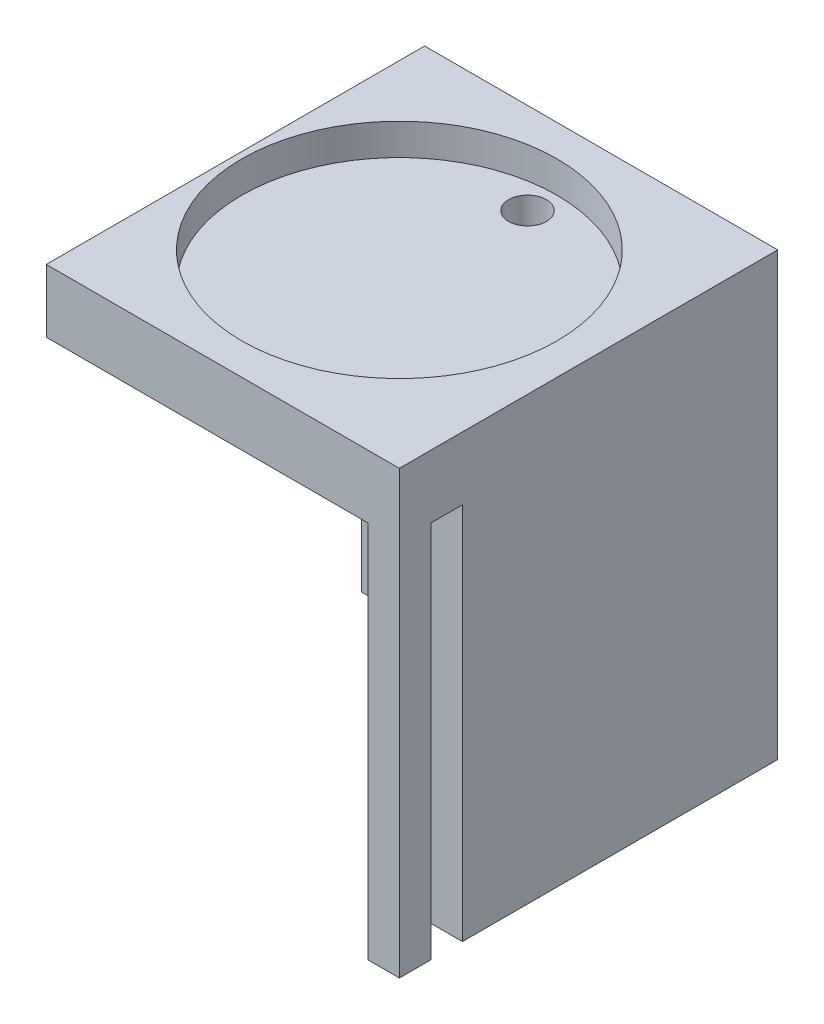
from build123d import *

# Parameters (mm, degrees)
SKETCH1_W                      = 670
SKETCH1_H                      = 120
BOSS_EXTRUDE1_DEPTH            = 530
SKETCH2_W                      = 100
SKETCH2_H                      = 200
SKETCH2_W_2                    = 650
SKETCH2_H_2                    = 250
CUT_EXTRUDE1_DEPTH             = 100
SKETCH3_R                      = 50
CUT_EXTRUDE2_DEPTH             = 260
F_12_0_12_DIAMETER_HOLE2_D     = 12
F_12_0_12_DIAMETER_HOLE2_DEPTH = 30
F_12_0_12_DIAMETER_HOLE2_TIP   = 3.605163714
SKETCH8_W                      = 650
SKETCH8_H                      = 50
BOSS_EXTRUDE2_DEPTH            = 5
SKETCH9_W                      = 10
SKETCH9_H                      = 250
CUT_EXTRUDE3_DEPTH             = 717
CUT_EXTRUDE4_DEPTH             = 5
SKETCH11_W                     = 10
SKETCH11_H                     = 100
BOSS_EXTRUDE3_DEPTH            = 78
BOSS_EXTRUDE3_2_DEPTH          = 78
BOSS_EXTRUDE3_3_DEPTH          = 78
SKETCH12_W                     = 20
SKETCH12_H                     = 30
CUT_EXTRUDE5_DEPTH             = 80
SKETCH15_W                     = 30
SKETCH15_H                     = 23.536156656
SKETCH15_H_2                   = 28.986603691
CUT_EXTRUDE7_DEPTH             = 35
SHELL1_T                       = -3
SKETCH16_W                     = 14
SKETCH16_H                     = 14
CUT_EXTRUDE8_DEPTH             = 35
SKETCH17_W                     = 5.729882812
SKETCH17_H                     = 17.428393554
SKETCH17_W_2                   = 13.369726562
SKETCH17_H_2                   = 3.342431641
BOSS_EXTRUDE4_DEPTH            = 5
CUT_EXTRUDE10_DEPTH            = 863.670273187
CUT_EXTRUDE10_DEPTH_BACK       = 863.670273187
SKETCH18_W                     = 670
SKETCH18_H                     = 250
CUT_EXTRUDE12_DEPTH            = 737.002717386
CUT_EXTRUDE12_DEPTH_BACK       = 737.002717386
SKETCH19_W                     = 558
SKETCH19_H                     = 280
CUT_EXTRUDE13_DEPTH            = 322.253793752
CUT_EXTRUDE13_DEPTH_BACK       = 322.253793752
SKETCH20_W                     = 120
SKETCH20_H                     = 140


with BuildPart() as part:
    # Sketch1 → Boss-Extrude1 (new body)
    with BuildSketch(Plane(origin=(0, 0, 0), x_dir=(1, 0, 0), z_dir=(0, 1, 0))):
        with Locations((335, 60)):
            Rectangle(SKETCH1_W, SKETCH1_H)
    extrude(amount=BOSS_EXTRUDE1_DEPTH)

    # Sketch2 → Cut-Extrude1 (cut)
    with BuildSketch(Plane.XY):
        with Locations((60, 380)):
            Rectangle(SKETCH2_W, SKETCH2_H)
        with Locations((170, 380)):
            Rectangle(SKETCH2_W, SKETCH2_H)
        with Locations((280, 380)):
            Rectangle(SKETCH2_W, SKETCH2_H)
        with Locations((390, 380)):
            Rectangle(SKETCH2_W, SKETCH2_H)
        with Locations((500, 380)):
            Rectangle(SKETCH2_W, SKETCH2_H)
        with Locations((610, 380)):
            Rectangle(SKETCH2_W, SKETCH2_H)
        with Locations((335, 135)):
            Rectangle(SKETCH2_W_2, SKETCH2_H_2)
    extrude(amount=-CUT_EXTRUDE1_DEPTH, mode=Mode.SUBTRACT)

    # Sketch3 → Cut-Extrude2 (cut)
    with BuildSketch(Plane(origin=(0, 530, 0), x_dir=(1, 0, 0), z_dir=(0, 1, 0))):
        with Locations(Location((60, 60, 0), (0, 0, 270))):
            Circle(SKETCH3_R)
        with Locations(Location((170, 60, 0), (0, 0, 270))):
            Circle(SKETCH3_R)
        with Locations(Location((280, 60, 0), (0, 0, 270))):
            Circle(SKETCH3_R)
        with Locations(Location((390, 60, 0), (0, 0, 270))):
            Circle(SKETCH3_R)
        with Locations(Location((500, 60, 0), (0, 0, 270))):
            Circle(SKETCH3_R)
        with Locations(Location((610, 60, 0), (0, 0, 270))):
            Circle(SKETCH3_R)
    extrude(amount=-CUT_EXTRUDE2_DEPTH, mode=Mode.SUBTRACT)

    # Ø12.0 (12) Diameter Hole2
    with Locations(Plane(origin=(59.704642413, 270, -102.411697903), x_dir=(0, 0, 1), z_dir=(0, 1, 0))):
        with Locations((0, 0), (-0.195888006, 111.8520513), (0.014838595, 221.167624818), (-0.341843303, 331.364008353), (0.657723149, 441.008646429), (1.288998006, 549.811854685)):
            Hole(F_12_0_12_DIAMETER_HOLE2_D / 2, depth=F_12_0_12_DIAMETER_HOLE2_DEPTH)
            with Locations((0, 0, -(F_12_0_12_DIAMETER_HOLE2_DEPTH + F_12_0_12_DIAMETER_HOLE2_TIP / 2))):  # 118° drill point
                Cone(0, F_12_0_12_DIAMETER_HOLE2_D / 2, F_12_0_12_DIAMETER_HOLE2_TIP, mode=Mode.SUBTRACT)

    # Sketch8 → Boss-Extrude2 (add)
    with BuildSketch(Plane.XY):
        with Locations((335, 305)):
            Rectangle(SKETCH8_W, SKETCH8_H)
    extrude(amount=-BOSS_EXTRUDE2_DEPTH)

    # Sketch9 → Cut-Extrude3 (cut)
    with BuildSketch(Plane(origin=(670, 0, 0), x_dir=(0, 0, -1), z_dir=(1, 0, 0))):
        with Locations((15, 135)):
            Rectangle(SKETCH9_W, SKETCH9_H)
    extrude(amount=-CUT_EXTRUDE3_DEPTH, mode=Mode.SUBTRACT)

    # Sketch10 → Cut-Extrude4 (cut)
    with BuildSketch(Plane(origin=(0, 10, 0), x_dir=(1, 0, 0), z_dir=(0, 1, 0))):
        Polygon((365, 61.943560596), (350, 87.924322709), (320, 87.924322709), (305, 61.943560596), (320, 35.962798482), (350, 35.962798482), align=None)
    extrude(amount=-CUT_EXTRUDE4_DEPTH, mode=Mode.SUBTRACT)

    # Sketch12 → Cut-Extrude5 (cut)
    with BuildSketch(Plane.XY.offset(-100)):
        with Locations((85.198613037, 245)):
            Rectangle(SKETCH12_W, SKETCH12_H)
        with Locations((195.198613037, 245)):
            Rectangle(SKETCH12_W, SKETCH12_H)
        with Locations((305.198613037, 245)):
            Rectangle(SKETCH12_W, SKETCH12_H)
        with Locations((415.198613037, 245)):
            Rectangle(SKETCH12_W, SKETCH12_H)
        with Locations((525.198613037, 245)):
            Rectangle(SKETCH12_W, SKETCH12_H)
        with Locations((635.198613037, 245)):
            Rectangle(SKETCH12_W, SKETCH12_H)
    extrude(amount=-CUT_EXTRUDE5_DEPTH, mode=Mode.SUBTRACT)

    # Sketch17 → Boss-Extrude4 (add)
    # profile 1 of 9: a face of its own
    with BuildSketch(Plane.XY):
        with BuildLine():
            Line((527.508830928, 289.835452458), (527.508830928, 307.263846012))
            Line((527.508830928, 307.263846012), (534.861434459, 307.263846012))
            add(Edge.make_bspline(
                [(534.861434459, 307.263846012), (535.181337774, 307.258256848), (535.803061116, 307.24739446), (536.703508491, 307.139069344), (537.544992916, 306.975202489), (538.325061607, 306.737496792), (539.040841948, 306.426020155), (539.698044515, 306.051894954), (540.290333057, 305.605079277), (540.822348212, 305.090232636), (541.284521701, 304.502523111), (541.692171296, 303.852565801), (542.030284458, 303.129762281), (542.309377095, 302.341316546), (542.5243908, 301.484161689), (542.679660381, 300.560045938), (542.773357357, 299.567500804), (542.783368073, 298.883107022), (542.788518428, 298.530997273)],
                knots=[0, 0, 0, 0, 1.135059408, 2.20595691, 3.214417064, 4.174978569, 5.094187092, 5.980001006, 6.853065862, 7.720814779, 8.600404634, 9.50058483, 10.438414914, 11.426825708, 12.465239141, 13.571113463, 14.750376389, 16, 16, 16, 16], degree=3))
            add(Edge.make_bspline(
                [(542.788518428, 298.530997273), (542.781740751, 298.180151665), (542.768592871, 297.499553336), (542.676885992, 296.511518461), (542.516733301, 295.591080531), (542.296748778, 294.736450427), (542.003051046, 293.953120444), (541.654236167, 293.233205539), (541.233025793, 292.585291498), (540.753136904, 292.000029304), (540.204772188, 291.484681411), (539.587651059, 291.044279297), (538.910779309, 290.668464036), (538.169670382, 290.361903209), (537.364073889, 290.124869172), (536.495133477, 289.954199984), (535.562644449, 289.853487388), (534.920131033, 289.841584621), (534.58911581, 289.835452458)],
                knots=[0, 0, 0, 0, 1.228418252, 2.382983832, 3.470276728, 4.496757894, 5.468023682, 6.394867725, 7.292157164, 8.167372942, 9.039072913, 9.918728341, 10.815246345, 11.744296628, 12.720973084, 13.750736166, 14.841206188, 16, 16, 16, 16], degree=3))
            Line((534.58911581, 289.835452458), (527.508830928, 289.835452458))
        make_face()
        with BuildLine():
            Line((533.238713741, 291.745413395), (534.048208904, 291.745413395))
            add(Edge.make_bspline(
                [(534.048208904, 291.745413395), (534.172894012, 291.749291978), (534.413033311, 291.756761998), (534.758676231, 291.825976613), (535.075745017, 291.938271137), (535.365749176, 292.094802589), (535.623404602, 292.300450923), (535.848862806, 292.551404902), (536.04776914, 292.844737637), (536.217685755, 293.190205032), (536.364284647, 293.596533622), (536.481764702, 294.076367921), (536.592118304, 294.630928744), (536.673672739, 295.265507643), (536.740044562, 295.978448886), (536.788346679, 296.768428292), (536.812018936, 297.636801208), (536.817188964, 298.241258393), (536.819890499, 298.55711002)],
                knots=[0, 0, 0, 0, 0.728710832, 1.403472396, 2.052289494, 2.690292559, 3.321919393, 3.970736491, 4.656696891, 5.388631723, 6.217040872, 7.17856157, 8.275589967, 9.523440737, 10.918935818, 12.463926104, 14.152268318, 16, 16, 16, 16], degree=3))
            add(Edge.make_bspline(
                [(536.819890499, 298.55711002), (536.8171426, 298.871715251), (536.811863063, 299.476166083), (536.7886758, 300.343334385), (536.739579947, 301.133216935), (536.674703848, 301.843934916), (536.589660404, 302.476324031), (536.488366458, 303.031681737), (536.362441588, 303.507627045), (536.222158727, 303.914921549), (536.050140993, 304.256514038), (535.858357073, 304.554097881), (535.62547107, 304.79746827), (535.36991257, 305.004888479), (535.079348843, 305.160875844), (534.761320266, 305.273944358), (534.414185903, 305.34216807), (534.172870641, 305.349893944), (534.048208904, 305.353885075)],
                knots=[0, 0, 0, 0, 1.842836665, 3.540640921, 5.080358154, 6.47765669, 7.719902824, 8.816971715, 9.781579111, 10.601733135, 11.334613876, 12.017393917, 12.666641099, 13.29908421, 13.937911793, 14.587567384, 15.270347425, 16, 16, 16, 16], degree=3))
            Line((534.048208904, 305.353885075), (533.238713741, 305.353885075))
            Line((533.238713741, 305.353885075), (533.238713741, 291.745413395))
        make_face(mode=Mode.SUBTRACT)
    # profile 2 of 9: a face of its own
    with BuildSketch(Plane.XY):
        with Locations((547.563420772, 298.549649235)):
            Rectangle(SKETCH17_W, SKETCH17_H)
    # profile 3 of 9: a face of its own
    with BuildSketch(Plane.XY):
        Polygon((564.514324092, 307.263846012), (564.514324092, 305.115139958), (558.545696163, 305.115139958), (558.545696163, 299.862747379), (563.559343624, 299.862747379), (563.559343624, 297.714041325), (558.545696163, 297.714041325), (558.545696163, 289.835452458), (552.81581335, 289.835452458), (552.81581335, 307.263846012), align=None)
    # profile 4 of 9: a face of its own
    with BuildSketch(Plane.XY):
        Polygon((577.645305538, 307.263846012), (577.645305538, 305.115139958), (571.676677608, 305.115139958), (571.676677608, 299.862747379), (576.690325069, 299.862747379), (576.690325069, 297.714041325), (571.676677608, 297.714041325), (571.676677608, 289.835452458), (565.946794795, 289.835452458), (565.946794795, 307.263846012), align=None)
    # profile 5 of 9: a face of its own
    with BuildSketch(Plane.XY):
        with Locations((584.330168819, 287.448001286)):
            Rectangle(SKETCH17_W_2, SKETCH17_H_2)
    # profile 6 of 9: a face of its own
    with BuildSketch(Plane.XY):
        with BuildLine():
            Line((605.578484249, 307.263846012), (605.578484249, 295.602639195))
            add(Edge.make_bspline(
                [(605.578484249, 295.602639195), (605.574209777, 295.35989389), (605.565919345, 294.889083964), (605.480877158, 294.20653885), (605.349958188, 293.569747554), (605.15926554, 292.978838165), (604.911867049, 292.436847071), (604.616163877, 291.936663973), (604.260702644, 291.487723021), (603.847299908, 291.08966617), (603.386881991, 290.731670113), (602.867295001, 290.425440037), (602.293741958, 290.168488385), (601.66690529, 289.960990771), (600.988052682, 289.797299786), (600.254912883, 289.679078851), (599.467035781, 289.60781007), (598.923618241, 289.60048219), (598.643684673, 289.59670734)],
                knots=[0, 0, 0, 0, 1.108173197, 2.149326602, 3.136215123, 4.073726706, 4.978516626, 5.852185058, 6.72141202, 7.584905625, 8.467554395, 9.379216169, 10.332422268, 11.332766067, 12.390653242, 13.518530507, 14.721707419, 16, 16, 16, 16], degree=3))
            add(Edge.make_bspline(
                [(598.643684673, 289.59670734), (598.373688491, 289.600411437), (597.851346557, 289.607577482), (597.093280473, 289.679448684), (596.387523889, 289.797736542), (595.733050135, 289.960122315), (595.130189942, 290.169220301), (594.579048171, 290.42623041), (594.078350789, 290.732835498), (593.633858028, 291.090104794), (593.234289459, 291.486851767), (592.899913678, 291.940746827), (592.609043638, 292.435866034), (592.375223767, 292.980322997), (592.191754821, 293.570441519), (592.063541006, 294.20666921), (591.983676196, 294.889343196), (591.974661767, 295.359932437), (591.970012569, 295.602639195)],
                knots=[0, 0, 0, 0, 1.258901956, 2.435505865, 3.547148904, 4.59359074, 5.576649289, 6.5183682, 7.424469602, 8.307507093, 9.172751023, 10.042627298, 10.928839176, 11.845659241, 12.799442865, 13.80597989, 14.868432463, 16, 16, 16, 16], degree=3))
            Line((591.970012569, 295.602639195), (591.970012569, 307.263846012))
            Line((591.970012569, 307.263846012), (597.699895381, 307.263846012))
            Line((597.699895381, 307.263846012), (597.699895381, 295.457153889))
            add(Edge.make_bspline(
                [(597.699895381, 295.457153889), (597.700816195, 295.287996189), (597.702584578, 294.963135903), (597.729908723, 294.499051493), (597.768241004, 294.079064133), (597.828226169, 293.705517832), (597.90066041, 293.377063412), (597.989882091, 293.09281535), (598.094998068, 292.852496478), (598.225239063, 292.654232043), (598.380826623, 292.495135011), (598.55368342, 292.353231761), (598.757556996, 292.238543846), (598.987648905, 292.146224908), (599.243380948, 292.070549638), (599.526120553, 292.020376099), (599.83553351, 291.990763905), (600.049971942, 291.986424568), (600.161954402, 291.984158512)],
                knots=[0, 0, 0, 0, 1.622370975, 3.115695595, 4.458049099, 5.666011203, 6.742434742, 7.681714947, 8.519814998, 9.250928664, 9.942747364, 10.646898194, 11.389596108, 12.175933929, 13.021386247, 13.943159715, 14.925891993, 16, 16, 16, 16], degree=3))
            add(Edge.make_bspline(
                [(600.161954402, 291.984158512), (600.283927219, 291.987190593), (600.521124756, 291.993087005), (600.86597014, 292.03390861), (601.187714881, 292.103380086), (601.484890424, 292.205377303), (601.758665297, 292.332852529), (602.012761516, 292.484567923), (602.236391413, 292.674631152), (602.439076761, 292.888441291), (602.620738276, 293.128529789), (602.771757722, 293.399928575), (602.905501548, 293.697121508), (603.005823683, 294.025060118), (603.089837826, 294.379999499), (603.146989706, 294.763086929), (603.186210275, 295.174074524), (603.189394751, 295.457053988), (603.191033077, 295.602639195)],
                knots=[0, 0, 0, 0, 1.083870311, 2.107775948, 3.08105344, 4.003637981, 4.893545291, 5.761570557, 6.624657808, 7.49233129, 8.376387281, 9.291996285, 10.246843261, 11.267344133, 12.334180325, 13.486053461, 14.706643157, 16, 16, 16, 16], degree=3))
            Line((603.191033077, 295.602639195), (603.191033077, 307.263846012))
            Line((603.191033077, 307.263846012), (605.578484249, 307.263846012))
        make_face()
    # profile 7 of 9: a face of its own
    with BuildSketch(Plane.XY):
        with BuildLine():
            Line((619.731593227, 302.015183827), (616.739818477, 301.526502415))
            add(Edge.make_bspline(
                [(616.739818477, 301.526502415), (616.748849224, 301.670726223), (616.765660669, 301.939210177), (616.78429066, 302.312269209), (616.796668381, 302.625642376), (616.798628236, 302.814722915), (616.799504756, 302.899286839)],
                knots=[0, 0, 0, 0, 1.261802504, 2.348944521, 3.261585937, 4, 4, 4, 4], degree=3))
            add(Edge.make_bspline(
                [(616.799504756, 302.899286839), (616.798306068, 303.007660677), (616.795968139, 303.219033721), (616.750451916, 303.523894877), (616.694806916, 303.811547356), (616.604352699, 304.076787391), (616.488181329, 304.320314265), (616.348943917, 304.543955606), (616.184187178, 304.745078709), (615.995833421, 304.928129987), (615.778009957, 305.083200131), (615.536269472, 305.218702836), (615.269765326, 305.333844758), (614.978065514, 305.431346685), (614.660683072, 305.504624438), (614.319025281, 305.556776695), (613.952471696, 305.585673441), (613.699597795, 305.590260771), (613.568984889, 305.592630192)],
                knots=[0, 0, 0, 0, 1.079280541, 2.105035848, 3.067950317, 3.99715044, 4.889989748, 5.753421302, 6.617030865, 7.476358039, 8.364190572, 9.274590025, 10.235106994, 11.254473582, 12.337095886, 13.478601727, 14.697662529, 16, 16, 16, 16], degree=3))
            add(Edge.make_bspline(
                [(613.568984889, 305.592630192), (613.391954632, 305.58912286), (613.059112606, 305.582528579), (612.595688488, 305.495339748), (612.198743126, 305.361419257), (611.87165349, 305.163811893), (611.613188167, 304.909795747), (611.433841092, 304.593316589), (611.323009072, 304.224665915), (611.313400221, 303.959558324), (611.308367061, 303.820693775)],
                knots=[0, 0, 0, 0, 1.294917039, 2.43462794, 3.440028966, 4.347597256, 5.210608309, 6.06356377, 6.985685997, 8, 8, 8, 8], degree=3))
            add(Edge.make_bspline(
                [(611.308367061, 303.820693775), (611.317562032, 303.705133219), (611.336106628, 303.472068433), (611.47315858, 303.132808312), (611.695999602, 302.811560885), (612.009295906, 302.510664216), (612.404107796, 302.221967273), (612.884407504, 301.948533431), (613.450813789, 301.688189695), (613.862519081, 301.536023727), (614.080048656, 301.455624958)],
                knots=[0, 0, 0, 0, 0.716839541, 1.445735977, 2.240793036, 3.131329288, 4.131129903, 5.273471266, 6.559404876, 8, 8, 8, 8], degree=3))
            add(Edge.make_bspline(
                [(614.080048656, 301.455624958), (614.335934702, 301.364918412), (614.834564244, 301.188164095), (615.547657928, 300.88707802), (616.213068388, 300.5749594), (616.829579094, 300.246613346), (617.397833174, 299.90520698), (617.914851624, 299.544556457), (618.386199073, 299.173962102), (618.807001026, 298.783874588), (619.177995113, 298.378100064), (619.4958685, 297.952745357), (619.771807525, 297.51723103), (619.991113975, 297.061458502), (620.169645242, 296.594624218), (620.292698657, 296.11024444), (620.364288243, 295.609761088), (620.37516617, 295.270864226), (620.380681514, 295.099036213)],
                knots=[0, 0, 0, 0, 1.359488612, 2.649152603, 3.874964776, 5.039588756, 6.146130126, 7.193090393, 8.194917302, 9.146793662, 10.063845301, 10.944476293, 11.803344532, 12.641736646, 13.473440096, 14.302714936, 15.139439897, 16, 16, 16, 16], degree=3))
            add(Edge.make_bspline(
                [(620.380681514, 295.099036213), (620.374476075, 294.902306495), (620.362285176, 294.515820995), (620.280160209, 293.948630617), (620.138011896, 293.409496554), (619.938489338, 292.895972278), (619.681049879, 292.411946655), (619.366518754, 291.954381076), (618.996510229, 291.525099427), (618.5710008, 291.128381035), (618.102222518, 290.765302239), (617.587803957, 290.450854345), (617.034458515, 290.187092261), (616.444107988, 289.968993032), (615.81453624, 289.801373099), (615.145337453, 289.685291013), (614.438790193, 289.606619894), (613.954683001, 289.600062276), (613.70700941, 289.59670734)],
                knots=[0, 0, 0, 0, 0.972121714, 1.909782367, 2.824924061, 3.721832975, 4.62620438, 5.527836938, 6.46026819, 7.421000932, 8.398101015, 9.385579713, 10.394244048, 11.422703992, 12.491421888, 13.608778581, 14.776629625, 16, 16, 16, 16], degree=3))
            add(Edge.make_bspline(
                [(613.70700941, 289.59670734), (613.445745367, 289.599650312), (612.939893069, 289.605348413), (612.207608113, 289.66709241), (611.525297432, 289.760984454), (610.893395078, 289.899706116), (610.309273131, 290.072394336), (609.776099392, 290.288320955), (609.295310255, 290.547303481), (608.863217672, 290.843007892), (608.478306623, 291.175775461), (608.148120946, 291.551766865), (607.86942369, 291.967163224), (607.639947144, 292.421521488), (607.466477665, 292.917583541), (607.339164663, 293.449829748), (607.264537999, 294.021332449), (607.254747521, 294.414908557), (607.249700069, 294.617815586)],
                knots=[0, 0, 0, 0, 1.342201143, 2.598733168, 3.773451092, 4.878874364, 5.91991243, 6.900006476, 7.829142054, 8.72062616, 9.585588575, 10.436728592, 11.283829734, 12.149664931, 13.044964919, 13.977937424, 14.957531465, 16, 16, 16, 16], degree=3))
            add(Edge.make_bspline(
                [(607.249700069, 294.617815586), (607.250803815, 294.692425759), (607.253213998, 294.855347393), (607.260452266, 295.122772538), (607.275636683, 295.433682216), (607.29037174, 295.656130545), (607.298195171, 295.774237248)],
                knots=[0, 0, 0, 0, 0.773500207, 1.689044709, 2.77302154, 4, 4, 4, 4], degree=3))
            Line((607.298195171, 295.774237248), (610.36457777, 296.337526509))
            add(Edge.make_bspline(
                [(610.36457777, 296.337526509), (610.326952988, 296.136337493), (610.255606535, 295.754830366), (610.178678473, 295.21219969), (610.124206629, 294.733311493), (610.11767002, 294.435147371), (610.114641475, 294.297001835)],
                knots=[0, 0, 0, 0, 1.192988372, 2.262218769, 3.194850416, 4, 4, 4, 4], degree=3))
            add(Edge.make_bspline(
                [(610.114641475, 294.297001835), (610.116191817, 294.183708768), (610.119182568, 293.965156219), (610.159053378, 293.648552813), (610.215988606, 293.352999663), (610.302906772, 293.079707227), (610.411206928, 292.826307836), (610.544682453, 292.59538211), (610.704385489, 292.386485019), (610.887496571, 292.200099922), (611.094689168, 292.033628705), (611.327456494, 291.892756696), (611.58347653, 291.771733922), (611.864681562, 291.677479524), (612.167961721, 291.596080628), (612.497219749, 291.548235723), (612.849461228, 291.512043782), (613.092629543, 291.508500084), (613.218327999, 291.506668278)],
                knots=[0, 0, 0, 0, 1.135776692, 2.191015738, 3.19649269, 4.151244236, 5.061952528, 5.956281389, 6.819534407, 7.692823504, 8.571441916, 9.478554956, 10.416037156, 11.406231466, 12.450054172, 13.561596327, 14.739541482, 16, 16, 16, 16], degree=3))
            add(Edge.make_bspline(
                [(613.218327999, 291.506668278), (613.423996012, 291.510791273), (613.810619321, 291.518541853), (614.349272542, 291.616708407), (614.810575885, 291.768742445), (615.189785268, 291.991387532), (615.490778961, 292.278756613), (615.698005174, 292.637320004), (615.824813318, 293.05638326), (615.837728413, 293.355975238), (615.844524288, 293.513619419)],
                knots=[0, 0, 0, 0, 1.308765556, 2.460272085, 3.475015317, 4.388076298, 5.239673503, 6.095681635, 6.997954785, 8, 8, 8, 8], degree=3))
            add(Edge.make_bspline(
                [(615.844524288, 293.513619419), (615.833808824, 293.638242951), (615.811807312, 293.894126055), (615.644884004, 294.264515838), (615.382382362, 294.620631473), (615.016807277, 294.962984909), (614.551376589, 295.293471235), (613.986957743, 295.616730224), (613.322148235, 295.933112033), (612.83677959, 296.119639164), (612.580430889, 296.21815395)],
                knots=[0, 0, 0, 0, 0.667930748, 1.371427933, 2.146459016, 3.034714139, 4.04893387, 5.207327294, 6.525042705, 8, 8, 8, 8], degree=3))
            add(Edge.make_bspline(
                [(612.580430889, 296.21815395), (612.374354345, 296.29679374), (611.970646869, 296.450850434), (611.394079385, 296.713586304), (610.853066711, 296.987016804), (610.357486361, 297.288235735), (609.896382561, 297.599610528), (609.477036946, 297.932256792), (609.09841673, 298.284556341), (608.758710772, 298.653375077), (608.457302107, 299.038989264), (608.199448649, 299.444659231), (607.977533299, 299.866789834), (607.798609588, 300.308107488), (607.65975715, 300.767821241), (607.559616231, 301.244439392), (607.497905054, 301.739995674), (607.491630423, 302.075933546), (607.488445186, 302.246468159)],
                knots=[0, 0, 0, 0, 1.249558333, 2.447906163, 3.58867143, 4.682264114, 5.731748367, 6.739728761, 7.711906036, 8.659384707, 9.578321416, 10.481344598, 11.379544271, 12.277135726, 13.175418307, 14.097160112, 15.034047388, 16, 16, 16, 16], degree=3))
            add(Edge.make_bspline(
                [(607.488445186, 302.246468159), (607.49282555, 302.439538736), (607.501402184, 302.817565692), (607.587451154, 303.36980586), (607.719291893, 303.894921371), (607.910558542, 304.389343064), (608.156192894, 304.852853762), (608.453187669, 305.288766511), (608.804241719, 305.697593471), (609.213503754, 306.066686531), (609.657214714, 306.407618241), (610.14376173, 306.697651931), (610.658716537, 306.950861947), (611.210636666, 307.148827868), (611.791820619, 307.313252612), (612.408080529, 307.421140415), (613.056315391, 307.490701612), (613.499160755, 307.498567824), (613.725661373, 307.502591129)],
                knots=[0, 0, 0, 0, 1.01033566, 1.978209831, 2.919499157, 3.840961976, 4.746855014, 5.660740114, 6.597989116, 7.56120833, 8.541877795, 9.523498025, 10.522416858, 11.542172371, 12.589598349, 13.681636521, 14.814234488, 16, 16, 16, 16], degree=3))
            add(Edge.make_bspline(
                [(613.725661373, 307.502591129), (613.968269855, 307.498219033), (614.438190994, 307.489750488), (615.120391152, 307.426787419), (615.755073228, 307.319142339), (616.345153155, 307.171557286), (616.887304575, 306.977590666), (617.384933999, 306.742393454), (617.834452216, 306.46201507), (618.236961315, 306.139451502), (618.593086714, 305.773322851), (618.897467704, 305.361641069), (619.158701245, 304.909408454), (619.366684143, 304.412232174), (619.529870326, 303.873247147), (619.649133834, 303.29158184), (619.720420497, 302.667301443), (619.72779778, 302.236712324), (619.731593227, 302.015183827)],
                knots=[0, 0, 0, 0, 1.248314423, 2.417925914, 3.521398822, 4.558068205, 5.543720209, 6.479599284, 7.385061127, 8.263440163, 9.127722873, 10.00561236, 10.891325273, 11.808802823, 12.772251995, 13.784947978, 14.860405143, 16, 16, 16, 16], degree=3))
        make_face()
    # profile 8 of 9: a face of its own
    with BuildSketch(Plane.XY):
        Polygon((633.989153194, 307.263846012), (633.989153194, 305.115139958), (628.020525264, 305.115139958), (628.020525264, 300.340237614), (633.034172725, 300.340237614), (633.034172725, 298.191531559), (628.020525264, 298.191531559), (628.020525264, 291.984158512), (634.944133663, 291.984158512), (634.944133663, 289.835452458), (622.290642452, 289.835452458), (622.290642452, 307.263846012), align=None)
    # profile 9 of 9: a face of its own
    with BuildSketch(Plane.XY):
        with BuildLine():
            Line((636.376604366, 289.835452458), (636.376604366, 307.263846012))
            Line((636.376604366, 307.263846012), (643.990335369, 307.263846012))
            add(Edge.make_bspline(
                [(643.990335369, 307.263846012), (644.237946498, 307.261150834), (644.721600887, 307.25588639), (645.426490561, 307.189203683), (646.094808274, 307.090496236), (646.724915796, 306.949857504), (647.317873659, 306.767252686), (647.871119087, 306.542146), (648.390701058, 306.282329135), (648.864494846, 305.976472528), (649.295093616, 305.642889252), (649.669668547, 305.279483604), (649.990389523, 304.894749072), (650.250664962, 304.483256345), (650.454275633, 304.048690948), (650.59581384, 303.587791605), (650.684089268, 303.104102537), (650.695510601, 302.772834174), (650.701311397, 302.604585835)],
                knots=[0, 0, 0, 0, 1.303269877, 2.545653735, 3.724355284, 4.8584284, 5.941462088, 6.987020715, 8.000098032, 8.995332524, 9.951400474, 10.863507538, 11.737823931, 12.582415999, 13.420128714, 14.25671499, 15.114600608, 16, 16, 16, 16], degree=3))
            add(Edge.make_bspline(
                [(650.701311397, 302.604585835), (650.698282873, 302.472674957), (650.692382063, 302.215658276), (650.651041486, 301.838684287), (650.580643818, 301.480313933), (650.481036683, 301.139915259), (650.347814833, 300.820175594), (650.191279492, 300.517863507), (650.009772227, 300.230553342), (649.788675198, 299.970497982), (649.548268341, 299.722842359), (649.274558803, 299.497116911), (648.974487035, 299.288655528), (648.642526299, 299.104010513), (648.287619671, 298.928055749), (647.899038177, 298.784921972), (647.486819978, 298.644749395), (647.19793098, 298.577036306), (647.049257183, 298.54218845)],
                knots=[0, 0, 0, 0, 1.057156483, 2.059775939, 3.035078039, 3.981068617, 4.897189472, 5.80650904, 6.70770952, 7.613691521, 8.536886357, 9.470937334, 10.45233069, 11.461024139, 12.51295332, 13.623444893, 14.776929983, 16, 16, 16, 16], degree=3))
            add(Edge.make_bspline(
                [(647.049257183, 298.54218845), (647.19164695, 298.499279419), (647.467865022, 298.416041346), (647.856360945, 298.265600017), (648.211652989, 298.111536308), (648.524185739, 297.936781388), (648.807636894, 297.762122504), (649.047122259, 297.564301324), (649.255235567, 297.361673563), (649.425188343, 297.135464734), (649.570253643, 296.882344437), (649.694827156, 296.586596707), (649.815179167, 296.247423665), (649.917667348, 295.859098311), (650.004750555, 295.423699276), (650.088222437, 294.944027189), (650.153853601, 294.416024546), (650.187587341, 294.048412906), (650.2051692, 293.856815525)],
                knots=[0, 0, 0, 0, 1.149282524, 2.229462177, 3.219229774, 4.139917433, 4.995948464, 5.788695735, 6.536448429, 7.236319808, 7.968460079, 8.78645307, 9.713791991, 10.749194692, 11.887975363, 13.146018663, 14.512518948, 16, 16, 16, 16], degree=3))
            add(Edge.make_bspline(
                [(650.2051692, 293.856815525), (650.225980287, 293.627849833), (650.265975604, 293.187817268), (650.348933081, 292.554613589), (650.44386163, 291.974357025), (650.555874504, 291.44528724), (650.681301216, 290.967898855), (650.821280597, 290.540469593), (650.979920039, 290.165788217), (651.10484481, 289.941461656), (651.163880062, 289.835452458)],
                knots=[0, 0, 0, 0, 1.324580516, 2.545615266, 3.678710841, 4.711533017, 5.660403917, 6.521349952, 7.301239649, 8, 8, 8, 8], degree=3))
            Line((651.163880062, 289.835452458), (645.213904094, 289.835452458))
            add(Edge.make_bspline(
                [(645.213904094, 289.835452458), (645.12229736, 290.069847279), (644.935171241, 290.548648246), (644.7595281, 291.319414791), (644.64846922, 292.142514735), (644.635117598, 292.70994511), (644.628232479, 293.002555653)],
                knots=[0, 0, 0, 0, 0.930410518, 1.900560147, 2.917368081, 4, 4, 4, 4], degree=3))
            Line((644.628232479, 293.002555653), (644.605850124, 294.002300831))
            Line((644.605850124, 294.002300831), (644.579737377, 295.266903874))
            add(Edge.make_bspline(
                [(644.579737377, 295.266903874), (644.573694669, 295.477395004), (644.562357007, 295.872330118), (644.469348432, 296.426164013), (644.30178735, 296.894645884), (644.073222546, 297.287223005), (643.766741442, 297.590613479), (643.39104803, 297.804152917), (642.950456912, 297.93396284), (642.634664848, 297.946292392), (642.468335247, 297.952786442)],
                knots=[0, 0, 0, 0, 1.295300309, 2.430314163, 3.439929415, 4.342995669, 5.203512789, 6.060756153, 6.978588463, 8, 8, 8, 8], degree=3))
            Line((642.468335247, 297.952786442), (642.106487178, 297.952786442))
            Line((642.106487178, 297.952786442), (642.106487178, 289.835452458))
            Line((642.106487178, 289.835452458), (636.376604366, 289.835452458))
        make_face()
        with BuildLine():
            Line((642.106487178, 299.862747379), (642.617550945, 299.862747379))
            add(Edge.make_bspline(
                [(642.617550945, 299.862747379), (642.722054451, 299.865172716), (642.925280724, 299.869889229), (643.220054897, 299.898289891), (643.494111408, 299.951809873), (643.749840966, 300.021017819), (643.984372137, 300.114851792), (644.200147241, 300.225818296), (644.391160406, 300.362685327), (644.565327067, 300.516342321), (644.718148635, 300.691986294), (644.850351299, 300.889034217), (644.961199162, 301.106225057), (645.056078491, 301.342818683), (645.125883912, 301.600830857), (645.173262731, 301.879472914), (645.203404658, 302.177423605), (645.207875435, 302.383174491), (645.210173702, 302.488943669)],
                knots=[0, 0, 0, 0, 1.184986479, 2.304423995, 3.352332712, 4.347714965, 5.303263624, 6.211353909, 7.091434645, 7.960150225, 8.839440182, 9.723126897, 10.64371617, 11.599264829, 12.608232147, 13.667459739, 14.800924404, 16, 16, 16, 16], degree=3))
            add(Edge.make_bspline(
                [(645.210173702, 302.488943669), (645.207875435, 302.594712847), (645.203404658, 302.800463732), (645.173262731, 303.098414423), (645.125883912, 303.37705648), (645.056078491, 303.635068654), (644.961199162, 303.87166228), (644.850351299, 304.08885312), (644.718148635, 304.285901043), (644.565327067, 304.461545017), (644.391160406, 304.61520201), (644.200147241, 304.752069041), (643.984372137, 304.863035546), (643.749840966, 304.956869518), (643.494111408, 305.026077464), (643.220054897, 305.079597446), (642.925280724, 305.107998108), (642.722054451, 305.112714621), (642.617550945, 305.115139958)],
                knots=[0, 0, 0, 0, 1.199075596, 2.332540261, 3.391767853, 4.400735171, 5.35628383, 6.276873103, 7.160559818, 8.039849775, 8.908565355, 9.788646091, 10.696736376, 11.652285035, 12.647667288, 13.695576005, 14.815013521, 16, 16, 16, 16], degree=3))
            Line((642.617550945, 305.115139958), (642.106487178, 305.115139958))
            Line((642.106487178, 305.115139958), (642.106487178, 299.862747379))
        make_face(mode=Mode.SUBTRACT)
    extrude(amount=BOSS_EXTRUDE4_DEPTH)

    # Sketch18 → Cut-Extrude10 (cut, two sides: drawn at the far end of the back side and taken through both)
    with BuildSketch(Plane.XY.offset(-CUT_EXTRUDE10_DEPTH_BACK)):
        with Locations((335, 405)):
            Rectangle(SKETCH18_W, SKETCH18_H)
    extrude(amount=CUT_EXTRUDE10_DEPTH + CUT_EXTRUDE10_DEPTH_BACK, mode=Mode.SUBTRACT)

    # Sketch19 → Cut-Extrude12 (cut, two sides: drawn at the far end of the back side and taken through both)
    with BuildSketch(Plane(origin=(0, 0, -120), x_dir=(-1, 0, 0), z_dir=(0, 0, -1)).offset(-CUT_EXTRUDE12_DEPTH_BACK)):
        with Locations((-279, 140)):
            Rectangle(SKETCH19_W, SKETCH19_H)
    extrude(amount=CUT_EXTRUDE12_DEPTH + CUT_EXTRUDE12_DEPTH_BACK, mode=Mode.SUBTRACT)

    # Sketch20 → Cut-Extrude13 (cut, two sides: drawn at the far end of the back side and taken through both)
    with BuildSketch(Plane.ZY.offset(-660).offset(-CUT_EXTRUDE13_DEPTH_BACK)):
        with Locations((-60, 70)):
            Rectangle(SKETCH20_W, SKETCH20_H)
    extrude(amount=CUT_EXTRUDE13_DEPTH + CUT_EXTRUDE13_DEPTH_BACK, mode=Mode.SUBTRACT)


with BuildPart() as body_2:
    # Sketch11 → Boss-Extrude3 (new body)
    with BuildSketch(Plane.XY.offset(-100)):
        with Locations((255, 60)):
            Rectangle(SKETCH11_W, SKETCH11_H)
    extrude(amount=BOSS_EXTRUDE3_DEPTH)


with BuildPart() as body_3:
    # Sketch11 → Boss-Extrude3 2 (new body)
    with BuildSketch(Plane.XY.offset(-100)):
        with Locations((415, 60)):
            Rectangle(SKETCH11_W, SKETCH11_H)
    extrude(amount=BOSS_EXTRUDE3_2_DEPTH)


with BuildPart() as body_4:
    # Sketch11 → Boss-Extrude3 3 (new body)
    with BuildSketch(Plane.XY.offset(-100)):
        Polygon((25, 198.45686471), (325, 145.558770497), (325, 122.01775856), (345, 122.01775856), (345, 145.558770497), (645, 198.45686471), align=None)
    extrude(amount=BOSS_EXTRUDE3_3_DEPTH)

    # Sketch15 → Cut-Extrude7 (cut)
    with BuildSketch(Plane(origin=(345, 0, 0), x_dir=(0, 0, -1), z_dir=(1, 0, 0))):
        with Locations((35, 133.231921672)):
            Rectangle(SKETCH15_W, SKETCH15_H)
        with Locations((85, 130.506698154)):
            Rectangle(SKETCH15_W, SKETCH15_H_2)
    extrude(amount=-CUT_EXTRUDE7_DEPTH, mode=Mode.SUBTRACT)

    # Shell1
    shell1_openings = [body_4.faces().sort_by_distance(p)[0] for p in [
        (335, 198.45686471, -61),
    ]]
    offset(amount=SHELL1_T, openings=shell1_openings, kind=Kind.INTERSECTION)

    # Sketch16 → Cut-Extrude8 (cut)
    with BuildSketch(Plane.XZ.offset(-122.01775856)):
        with Locations((335, -60)):
            Rectangle(SKETCH16_W, SKETCH16_H)
    extrude(amount=-CUT_EXTRUDE8_DEPTH, mode=Mode.SUBTRACT)


solid = part.part
